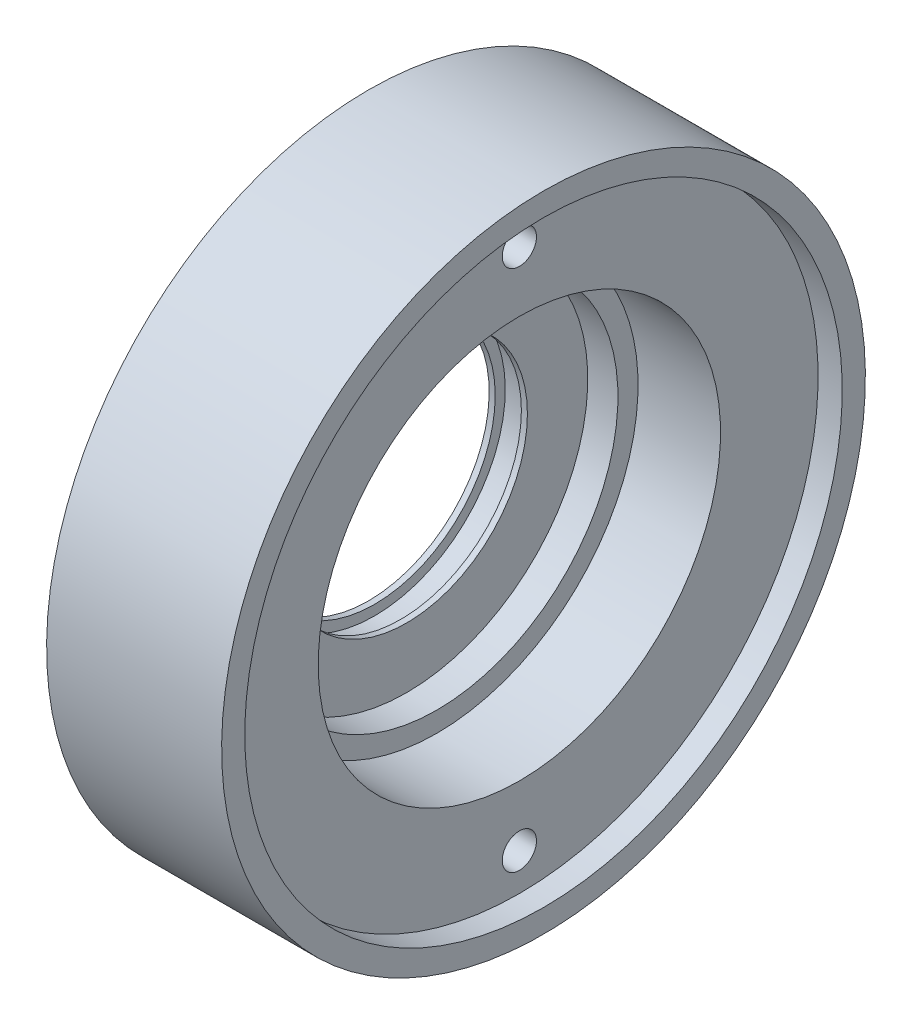
from build123d import *

# Parameters (mm, degrees)
ESQUISSE1_W             = 87
ESQUISSE1_H             = 160
ESQUISSE2_R             = 148.5
ENL_V_MAT_EXTRU_1_DEPTH = 12
ESQUISSE2_3_R           = 100
ESQUISSE2_3_R_2         = 90
ENL_V_MAT_EXTRU_2_DEPTH = 53
ESQUISSE4_R             = 90
ENL_V_MAT_EXTRU_3_DEPTH = 56
ESQUISSE10_R            = 60
ENL_V_MAT_EXTRU_4_DEPTH = 56
ENL_V_START             = 3
ESQUISSE11_R            = 65
ENL_V_MAT_EXTRU_7_DEPTH = 13
PER_AGE2_D              = 17
PER_AGE2_DEPTH          = 83
PER_AGE2_CBORE_D        = 25
PER_AGE2_CBORE_DEPTH    = 16


with BuildPart() as part:
    # Esquisse1 → Révolution1 (revolve)
    with BuildSketch(Plane.XY):
        with Locations((43.5, 80)):
            Rectangle(ESQUISSE1_W, ESQUISSE1_H)
    revolve(axis=Axis((87, 0, 0), (-1, 0, 0)))

    # Esquisse2 → Enlèv. mat.-Extru.1 (cut)
    with BuildSketch(Plane(origin=(87, 0, 0), x_dir=(0, 0, -1), z_dir=(1, 0, 0))):
        Circle(ESQUISSE2_R)
    extrude(amount=-ENL_V_MAT_EXTRU_1_DEPTH, mode=Mode.SUBTRACT)

    # Esquisse2<3> → Enlèv. mat.-Extru.2 (cut)
    with BuildSketch(Plane(origin=(87, 0, 0), x_dir=(0, 0, -1), z_dir=(1, 0, 0))):
        Circle(ESQUISSE2_3_R)
        Circle(ESQUISSE2_3_R_2, mode=Mode.SUBTRACT)
    extrude(amount=-ENL_V_MAT_EXTRU_2_DEPTH, mode=Mode.SUBTRACT)

    # Esquisse4 → Enlèv. mat.-Extru.3 (cut)
    with BuildSketch(Plane(origin=(75, 0, 0), x_dir=(0, 0, -1), z_dir=(1, 0, 0))):
        Circle(ESQUISSE4_R)
    extrude(amount=-ENL_V_MAT_EXTRU_3_DEPTH, mode=Mode.SUBTRACT)

    # Esquisse10 → Enlèv. mat.-Extru.4 (cut)
    with BuildSketch(Plane.ZY):
        Circle(ESQUISSE10_R)
    extrude(amount=-ENL_V_MAT_EXTRU_4_DEPTH, mode=Mode.SUBTRACT)

    # Esquisse11 → Enlèv. mat.-Extru.7 (cut)
    with BuildSketch(Plane(origin=(0, 0, 0), x_dir=(0, 0, -1), z_dir=(1, 0, 0)).offset(ENL_V_START)):
        Circle(ESQUISSE11_R)
    extrude(amount=ENL_V_MAT_EXTRU_7_DEPTH, mode=Mode.SUBTRACT)

    # Perçage2
    with Locations(Plane(origin=(0, 130, 0), x_dir=(0, 0, -1), z_dir=(-1, 0, 0))):
        with Locations((0, 0), (0, 260)):
            CounterBoreHole(PER_AGE2_D / 2, PER_AGE2_CBORE_D / 2, PER_AGE2_CBORE_DEPTH, depth=PER_AGE2_DEPTH)


solid = part.part
